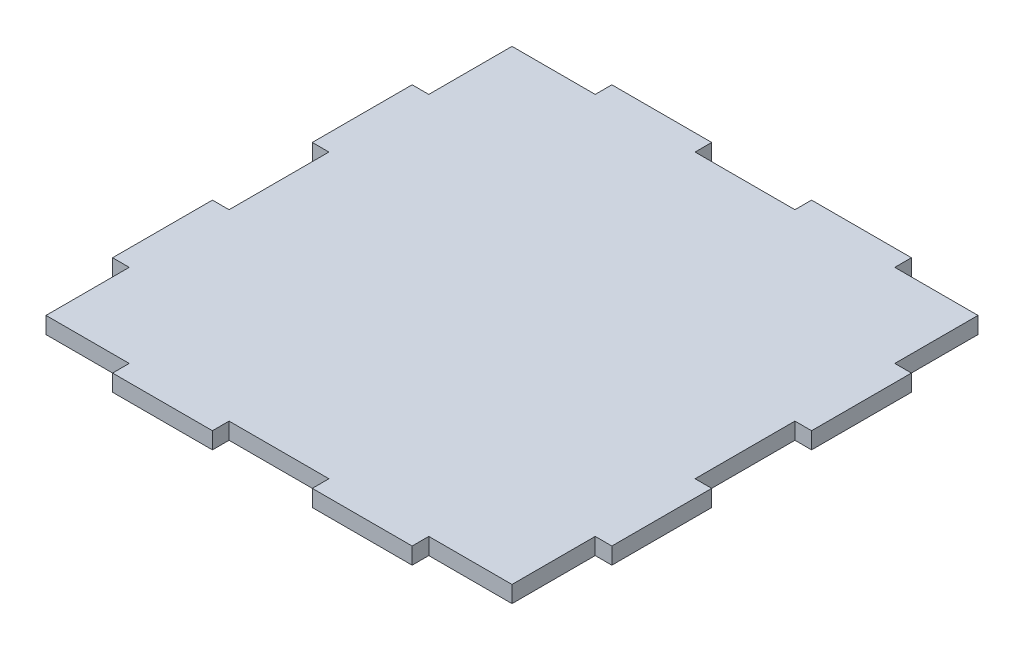
from build123d import *

# Parameters (mm, degrees)
BOSS_EXTRUDE1_DEPTH = 3


with BuildPart() as part:
    # Sketch1 → Boss-Extrude1 (new body)
    with BuildSketch(Plane(origin=(0, 0, 0), x_dir=(1, 0, 0), z_dir=(0, 1, 0))):
        Polygon((-27, -42), (-27, -45), (-9, -45), (-9, -42), (9, -42), (9, -45), (27, -45), (27, -42), (42, -42), (42, -27), (45, -27), (45, -9), (42, -9), (42, 9), (45, 9), (45, 27), (42, 27), (42, 42), (27, 42), (27, 45), (9, 45), (9, 42), (-9, 42), (-9, 45), (-27, 45), (-27, 42), (-42, 42), (-42, 27), (-45, 27), (-45, 9), (-42, 9), (-42, -9), (-45, -9), (-45, -27), (-42, -27), (-42, -42), align=None)
    extrude(amount=BOSS_EXTRUDE1_DEPTH)


solid = part.part
